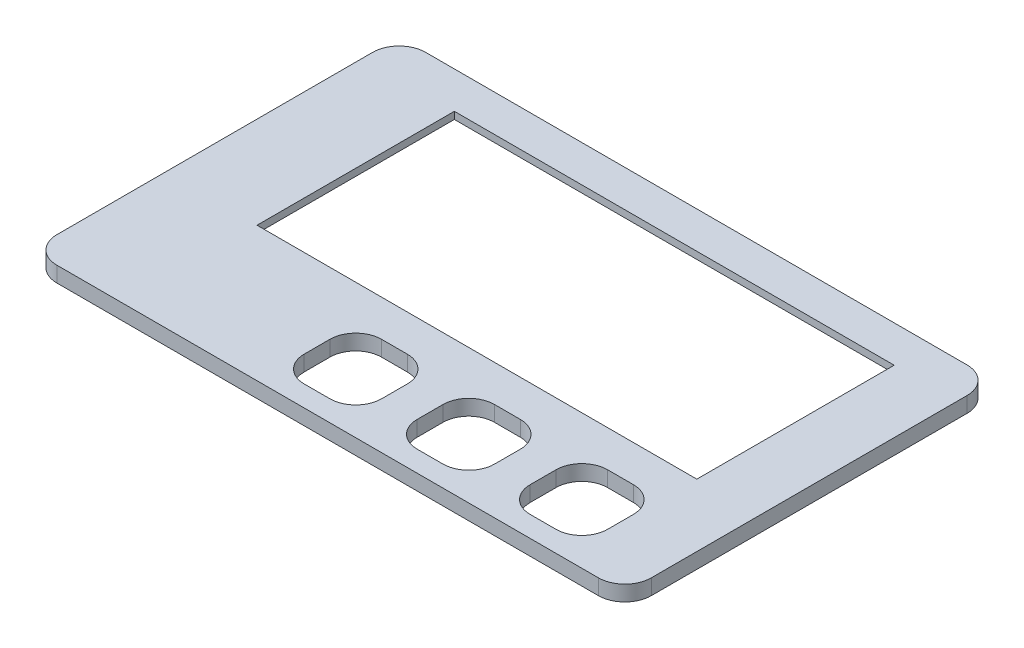
from build123d import *

# Parameters (mm, degrees)
SKETCH_1_W          = 11.999999915
SKETCH_1_H          = 11.994665989
SKETCH_1_W_2        = 11.999999916
SKETCH_1_H_2        = 12.000914401
SKETCH_1_W_3        = 68.2
SKETCH_1_H_3        = 30.6
EXTRUDE_1_DEPTH     = 2.4
CUT_EXTRUDE_1_DEPTH = 1.3
FILLET_1_R          = 4


with BuildPart() as part:
    # 草图1 → 凸台-拉伸1 (new body)
    with BuildSketch(Plane(origin=(0, 0, 0), x_dir=(1, 0, 0), z_dir=(0, 1, 0))):
        with BuildLine():
            Line((4.2, -0.1), (88.17478029, -0.1))
            ThreePointArc((88.17478029, -0.1), (91.073918092, -1.300862197), (92.27478029, -4.2))
            Line((92.27478029, -4.2), (92.27478029, -53.174709169))
            ThreePointArc((92.27478029, -53.174709169), (91.073918092, -56.073846972), (88.17478029, -57.274709169))
            Line((88.17478029, -57.274709169), (4.2, -57.274709169))
            ThreePointArc((4.2, -57.274709169), (1.300862197, -56.073846972), (0.1, -53.174709169))
            Line((0.1, -53.174709169), (0.1, -4.2))
            ThreePointArc((0.1, -4.2), (1.300862197, -1.300862197), (4.2, -0.1))
        make_face()
        with Locations((41.319380239, -48.050393701)):
            Rectangle(SKETCH_1_W, SKETCH_1_H, mode=Mode.SUBTRACT)
        with Locations((58.845415291, -48.050393701)):
            Rectangle(SKETCH_1_W, SKETCH_1_H, mode=Mode.SUBTRACT)
        with Locations((76.371450343, -48.047269495)):
            Rectangle(SKETCH_1_W_2, SKETCH_1_H_2, mode=Mode.SUBTRACT)
        with Locations((48.452479045, -21.09040811)):
            Rectangle(SKETCH_1_W_3, SKETCH_1_H_3, mode=Mode.SUBTRACT)
    extrude(amount=EXTRUDE_1_DEPTH)

    # 草图2 → 切除-拉伸1 (cut)
    with BuildSketch(Plane.XZ):
        with BuildLine():
            Line((88.152479045, 39.536375413), (4.206301753, 39.536375413))
            ThreePointArc((4.206301753, 39.536375413), (2.509245478, 38.833431688), (1.806301753, 37.136375413))
            Line((1.806301753, 37.136375413), (1.806301753, 4.190299721))
            ThreePointArc((1.806301753, 4.190299721), (2.509245478, 2.493243446), (4.206301753, 1.790299721))
            Line((4.206301753, 1.790299721), (88.152479045, 1.790299721))
            ThreePointArc((88.152479045, 1.790299721), (89.84953532, 2.493243446), (90.552479045, 4.190299721))
            Line((90.552479045, 4.190299721), (90.552479045, 37.136375413))
            ThreePointArc((90.552479045, 37.136375413), (89.84953532, 38.833431688), (88.152479045, 39.536375413))
        make_face()
    extrude(amount=-CUT_EXTRUDE_1_DEPTH, mode=Mode.SUBTRACT)

    # 圆角1
    fillet_1_edges = [part.edges().sort_by_distance(p)[0] for p in [
        (70.371450385, 1.2, 42.046812294),
        (70.371450385, 1.2, 54.047726695),
        (82.371450301, 1.2, 54.047726695),
        (82.371450301, 1.2, 42.046812294),
        (52.845415333, 1.2, 42.053060706),
        (52.845415333, 1.2, 54.047726695),
        (64.845415248, 1.2, 54.047726695),
        (64.845415248, 1.2, 42.053060706),
        (35.319380281, 1.2, 42.053060706),
        (35.319380281, 1.2, 54.047726695),
        (47.319380196, 1.2, 54.047726695),
        (47.319380196, 1.2, 42.053060706),
    ]]
    fillet(fillet_1_edges, radius=FILLET_1_R)


solid = part.part
